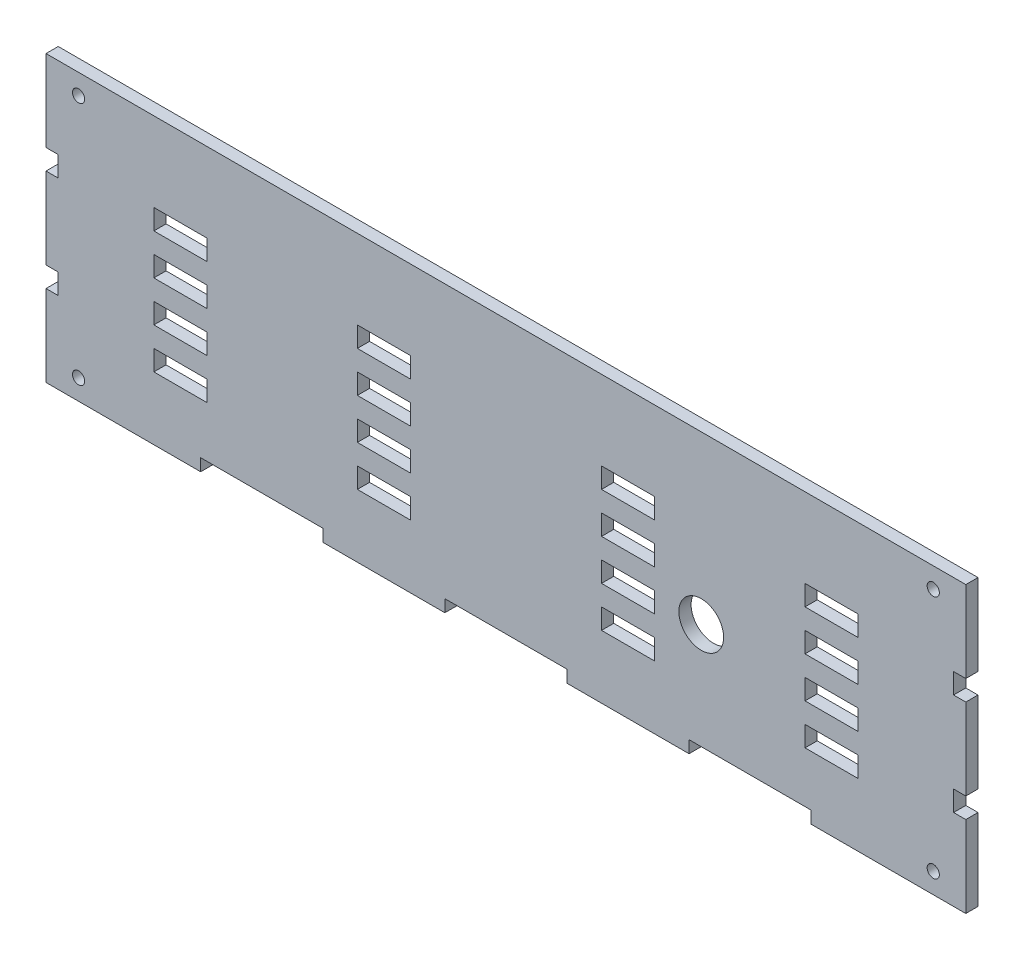
from build123d import *

# Parameters (mm, degrees)
SKETCH1_W           = 220
SKETCH1_H           = 70
BOSS_EXTRUDE1_DEPTH = 3
SKETCH2_2_R         = 1.5
CUT_EXTRUDE2_DEPTH  = 231.887418453
SKETCH3_W           = 3
SKETCH3_H           = 20
BOSS_EXTRUDE4_DEPTH = 3
LPATTERN1_COUNT     = 2
LPATTERN1_PITCH     = 25
LPATTERN1_COL_COUNT = 2
LPATTERN1_COL_PITCH = 25
SKETCH4_W           = 30
SKETCH4_H           = 3
CUT_EXTRUDE3_DEPTH  = 234.747727262
SKETCH5_R           = 5.5
CUT_EXTRUDE4_DEPTH  = 234.747727262
SKETCH6_W           = 13
SKETCH6_H           = 5
CUT_EXTRUDE5_DEPTH  = 234.747727262


with BuildPart() as part:
    # Sketch1 → Boss-Extrude1 (new body)
    with BuildSketch(Plane.XY):
        with Locations((110, 35)):
            Rectangle(SKETCH1_W, SKETCH1_H)
    extrude(amount=BOSS_EXTRUDE1_DEPTH)

    # Sketch2<2> → Cut-Extrude2 (cut, through all)
    with BuildSketch(Plane.XY.offset(3)):
        with Locations((5, 65)):
            Circle(SKETCH2_2_R)
        with Locations((5, 5)):
            Circle(SKETCH2_2_R)
        with Locations((215, 5)):
            Circle(SKETCH2_2_R)
        with Locations((215, 65)):
            Circle(SKETCH2_2_R)
    extrude(amount=-CUT_EXTRUDE2_DEPTH, mode=Mode.SUBTRACT)

    # Sketch3 → Boss-Extrude4 (add)
    with BuildSketch(Plane.XY.offset(3)):
        with Locations((-1.5, 35)):
            Rectangle(SKETCH3_W, SKETCH3_H)
        with Locations((221.5, 35)):
            Rectangle(SKETCH3_W, SKETCH3_H)
    boss_extrude4 = extrude(amount=-BOSS_EXTRUDE4_DEPTH)

    # LPattern1: Boss-Extrude4 ×2
    with Locations(*[(0, i * LPATTERN1_PITCH, 0) for i in range(1, LPATTERN1_COUNT)]):
        add(boss_extrude4)

    # LPattern1 col: Boss-Extrude4 ×2
    with Locations(*[(0, -i * LPATTERN1_COL_PITCH, 0) for i in range(1, LPATTERN1_COL_COUNT)]):
        add(boss_extrude4)

    # Sketch4 → Cut-Extrude3 (cut, through all)
    with BuildSketch(Plane(origin=(0, 0, 0), x_dir=(-1, 0, 0), z_dir=(0, 0, -1))):
        with Locations((-170, 1.5)):
            Rectangle(SKETCH4_W, SKETCH4_H)
        with Locations((-110, 1.5)):
            Rectangle(SKETCH4_W, SKETCH4_H)
        with Locations((-50, 1.5)):
            Rectangle(SKETCH4_W, SKETCH4_H)
    extrude(amount=-CUT_EXTRUDE3_DEPTH, mode=Mode.SUBTRACT)

    # Sketch5 → Cut-Extrude4 (cut, through all)
    with BuildSketch(Plane.XY.offset(3)):
        with Locations((158, 29)):
            Circle(SKETCH5_R)
    extrude(amount=-CUT_EXTRUDE4_DEPTH, mode=Mode.SUBTRACT)

    # Sketch6 → Cut-Extrude5 (cut, through all)
    with BuildSketch(Plane(origin=(0, 0, 0), x_dir=(-1, 0, 0), z_dir=(0, 0, -1))):
        with Locations((-140, 48)):
            Rectangle(SKETCH6_W, SKETCH6_H)
        with Locations((-190, 48)):
            Rectangle(SKETCH6_W, SKETCH6_H)
        with Locations((-190, 38)):
            Rectangle(SKETCH6_W, SKETCH6_H)
        with Locations((-190, 28)):
            Rectangle(SKETCH6_W, SKETCH6_H)
        with Locations((-190, 18)):
            Rectangle(SKETCH6_W, SKETCH6_H)
        with Locations((-140, 38)):
            Rectangle(SKETCH6_W, SKETCH6_H)
        with Locations((-140, 28)):
            Rectangle(SKETCH6_W, SKETCH6_H)
        with Locations((-140, 18)):
            Rectangle(SKETCH6_W, SKETCH6_H)
        with Locations((-80, 18)):
            Rectangle(SKETCH6_W, SKETCH6_H)
        with Locations((-80, 28)):
            Rectangle(SKETCH6_W, SKETCH6_H)
        with Locations((-80, 38)):
            Rectangle(SKETCH6_W, SKETCH6_H)
        with Locations((-30, 18)):
            Rectangle(SKETCH6_W, SKETCH6_H)
        with Locations((-30, 28)):
            Rectangle(SKETCH6_W, SKETCH6_H)
        with Locations((-30, 38)):
            Rectangle(SKETCH6_W, SKETCH6_H)
        with Locations((-30, 48)):
            Rectangle(SKETCH6_W, SKETCH6_H)
        with Locations((-80, 48)):
            Rectangle(SKETCH6_W, SKETCH6_H)
    extrude(amount=-CUT_EXTRUDE5_DEPTH, mode=Mode.SUBTRACT)


solid = part.part
